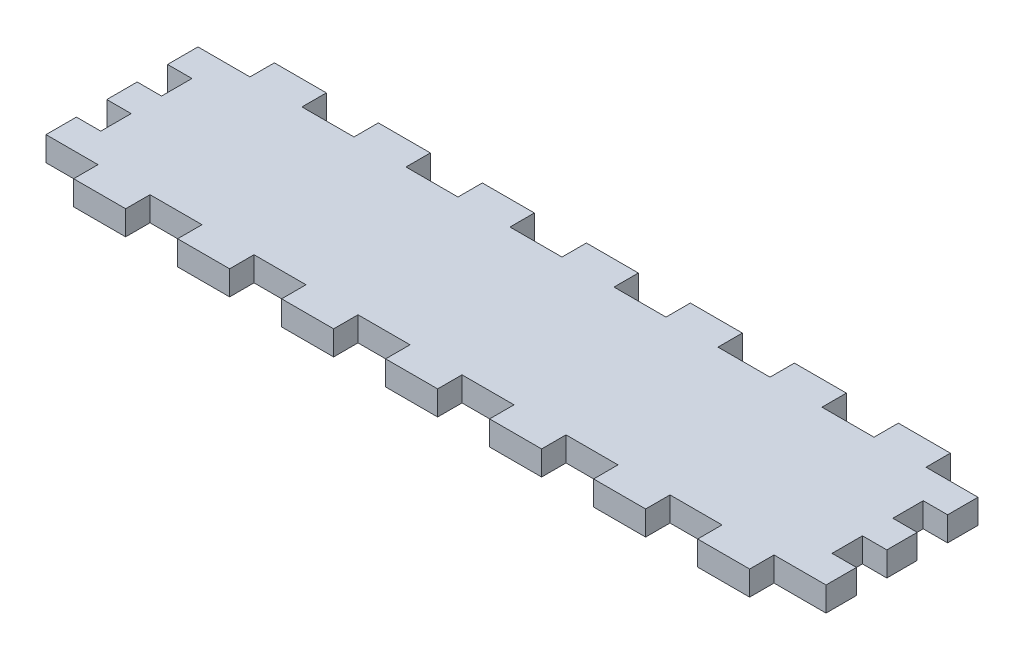
from build123d import *

# Parameters (mm, degrees)
BOSS_EXTRUDE1_DEPTH = 6.35


with BuildPart() as part:
    # Sketch1 → Boss-Extrude1 (new body)
    with BuildSketch(Plane(origin=(0, 0, 0), x_dir=(1, 0, 0), z_dir=(0, 1, 0))):
        Polygon((-61.908156531, -0.149800513), (-61.908156531, -8.067378744), (-55.558156531, -8.067378744), (-55.558156531, -15.984956974), (-61.908156531, -15.984956974), (-61.908156531, -23.902535204), (-48.361489864, -23.902535204), (-48.361489864, -30.252535204), (-34.814823197, -30.252535204), (-34.814823197, -23.902535204), (-21.268659618, -23.902535204), (-21.268659618, -30.252535194), (-7.722496038, -30.252535194), (-7.722496038, -23.902535204), (5.823667541, -23.902535204), (5.823667541, -30.252535194), (19.36983112, -30.252535194), (19.36983112, -23.902535204), (32.9159947, -23.902535204), (32.9159947, -30.252535194), (46.462158279, -30.252535194), (46.462158279, -23.902535204), (60.008321858, -23.902535204), (60.008321858, -30.252535194), (73.554485438, -30.252535194), (73.554485438, -23.902535204), (87.100649017, -23.902535204), (87.100649017, -30.252535194), (100.646812596, -30.252535194), (100.646812596, -23.902535204), (114.195156221, -23.902535204), (114.195156221, -30.252535194), (127.743499845, -30.252535194), (127.743499845, -23.902535204), (141.291843469, -23.902535204), (141.291843469, -15.984956974), (134.941843469, -15.984956974), (134.941843469, -8.067378744), (141.291843469, -8.067378744), (141.291843469, -0.149800513), (134.941843469, -0.149800513), (134.941843469, 7.767777717), (141.291843469, 7.767777717), (141.291843469, 15.685355948), (127.745176789, 15.685355948), (127.745176789, 22.035355948), (114.198510108, 22.035355948), (114.198510108, 15.685355948), (100.651843427, 15.685355948), (100.651843427, 22.035355948), (87.105176765, 22.035355948), (87.105176765, 15.685355948), (73.558510102, 15.685355948), (73.558510102, 22.035355948), (60.01184344, 22.035355948), (60.01184344, 15.685355948), (46.465176777, 15.685355948), (46.465176777, 22.035355948), (32.918510115, 22.035355948), (32.918510115, 15.685355948), (19.371843452, 15.685355948), (19.371843452, 22.035355948), (5.82517679, 22.035355948), (5.82517679, 15.685355948), (-7.721489872, 15.685355948), (-7.721489872, 22.035355948), (-21.268156535, 22.035355948), (-21.268156535, 15.685355948), (-34.814823197, 15.685355948), (-34.814823197, 22.035355948), (-48.361489864, 22.035355948), (-48.361489864, 15.685355948), (-61.908156531, 15.685355948), (-61.908156531, 7.767777717), (-55.558156531, 7.767777717), (-55.558156531, -0.149800513), align=None)
    extrude(amount=BOSS_EXTRUDE1_DEPTH)


solid = part.part
